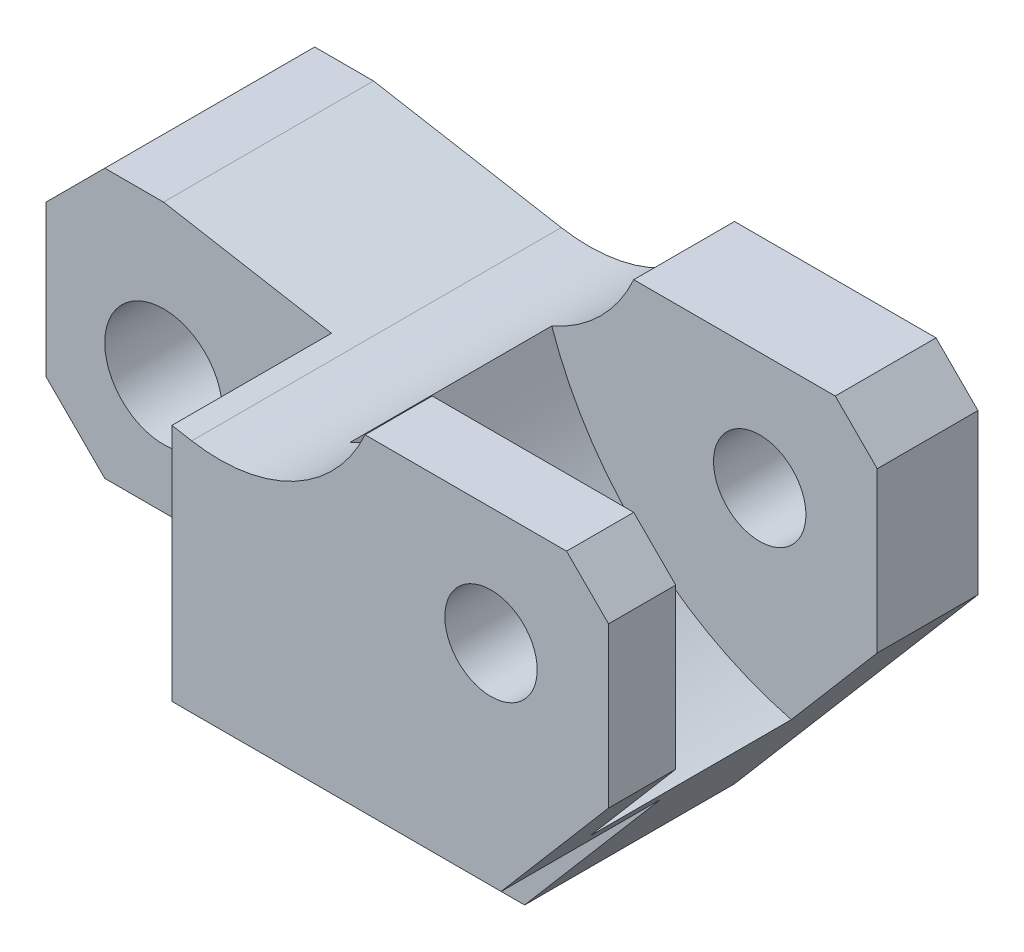
from build123d import *

# Parameters (mm, degrees)
ESQUISSE1_R             = 7
ESQUISSE1_R_2           = 5.5
BOSS_EXTRU_1_DEPTH      = 44
CHANFREIN1_SIZE         = 7
CHANFREIN2_SIZE         = 5
ESQUISSE2_W             = 34
ESQUISSE2_H             = 19
ENL_V_MAT_EXTRU_1_DEPTH = 103.391405889
ESQUISSE4_W             = 19
ESQUISSE4_H             = 19
ENL_V_MAT_EXTRU_2_DEPTH = 103.08329932
ENL_V_START             = -12
ENL_V_MAT_EXTRU_3_DEPTH = 24


with BuildPart() as part:
    # Esquisse1 → Boss.-Extru.1 (new body)
    with BuildSketch(Plane.XY):
        with BuildLine():
            Line((-14, 18), (0, 18))
            Line((0, 18), (22.361380836, 14.057085233))
            ThreePointArc((22.361380836, 14.057085233), (34.561098706, 15.982044142), (43, 25))
            Line((43, 25), (67, 25))
            Line((67, 25), (72, 25))
            Line((72, 25), (72, 1))
            Line((72, 1), (43, -33))
            Line((43, -33), (37.296980053, -33))
            ThreePointArc((37.296980053, -33), (32.858007856, -26.115672061), (30.521177653, -18.264705882))
            ThreePointArc((30.521177653, -18.264705882), (28.840774692, -15.213413768), (25.575538911, -14))
            Line((25.575538911, -14), (-14, -14))
            Line((-14, -14), (-14, 18))
        make_face()
        Circle(ESQUISSE1_R, mode=Mode.SUBTRACT)
        with Locations((58, 11)):
            Circle(ESQUISSE1_R_2, mode=Mode.SUBTRACT)
    extrude(amount=BOSS_EXTRU_1_DEPTH)

    # Chanfrein1
    chanfrein1_edges = [part.edges().sort_by_distance(p)[0] for p in [
        (-14, -14, 22),
        (-14, 18, 22),
    ]]
    chamfer(chanfrein1_edges, length=CHANFREIN1_SIZE)

    # Chanfrein2
    chanfrein2_edges = [part.edges().sort_by_distance(p)[0] for p in [
        (72, 25, 22),
    ]]
    chamfer(chanfrein2_edges, length=CHANFREIN2_SIZE)

    # Esquisse2 → Enlèv. mat.-Extru.1 (cut, through all)
    with BuildSketch(Plane(origin=(0, 25, 0), x_dir=(1, 0, 0), z_dir=(0, 1, 0))):
        with Locations((3, -34.5)):
            Rectangle(ESQUISSE2_W, ESQUISSE2_H)
    extrude(amount=-ENL_V_MAT_EXTRU_1_DEPTH, mode=Mode.SUBTRACT)

    # Esquisse4 → Enlèv. mat.-Extru.2 (cut, through all)
    with BuildSketch(Plane(origin=(72, 0, 0), x_dir=(0, 0, -1), z_dir=(1, 0, 0))):
        with Locations((-34.5, -23.5)):
            Rectangle(ESQUISSE4_W, ESQUISSE4_H)
    extrude(amount=-ENL_V_MAT_EXTRU_2_DEPTH, mode=Mode.SUBTRACT)

    # Esquisse5 → Enlèv. mat.-Extru.3 (cut)
    with BuildSketch(Plane(origin=(0, 0, 0), x_dir=(-1, 0, 0), z_dir=(0, 0, -1)).offset(ENL_V_START)):
        with BuildLine():
            Line((-43, 25), (-67, 25))
            Line((-67, 25), (-72, 20))
            Line((-72, 20), (-72, 1))
            Line((-72, 1), (-61.764705882, -11))
            ThreePointArc((-61.764705882, -11), (-44.184262982, -1.419294771), (-33.236936549, 15.344294617))
            ThreePointArc((-33.236936549, 15.344294617), (-39.021244343, 19.259333621), (-43, 25))
        make_face()
    extrude(amount=-ENL_V_MAT_EXTRU_3_DEPTH, mode=Mode.SUBTRACT)


solid = part.part
